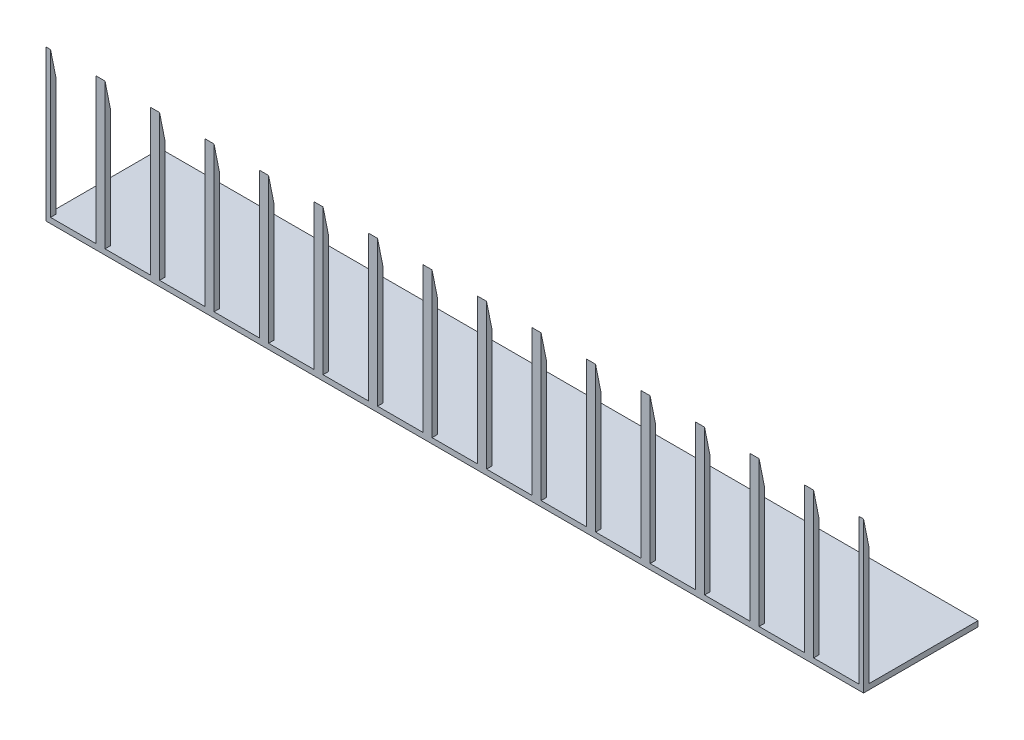
from build123d import *

# Parameters (mm, degrees)
SKETCH_1_W          = 450
SKETCH_1_H          = 60
EXTRUDE_1_DEPTH     = 3
EXTRUDE_2_DEPTH     = 3
CUT_EXTRUDE_1_DEPTH = 462.507313051


with BuildPart() as part:
    # 草图1 → 凸台-拉伸1 (new body)
    with BuildSketch(Plane(origin=(0, 0, 0), x_dir=(1, 0, 0), z_dir=(0, 1, 0))):
        with Locations((225, 30)):
            Rectangle(SKETCH_1_W, SKETCH_1_H)
    extrude(amount=EXTRUDE_1_DEPTH)

    # 草图3 → 凸台-拉伸2 (add)
    with BuildSketch(Plane.XY):
        Polygon((0, 0), (0, 83), (2.5, 83), (2.5, 3), (27.5, 3), (27.5, 83), (32.5, 83), (32.5, 3), (57.5, 3), (57.5, 83), (62.5, 83), (62.5, 3), (87.5, 3), (87.5, 83), (92.5, 83), (92.5, 3), (117.5, 3), (117.5, 83), (122.5, 83), (122.5, 3), (147.5, 3), (147.5, 83), (152.5, 83), (152.5, 3), (177.5, 3), (177.5, 83), (182.5, 83), (182.5, 3), (207.5, 3), (207.5, 83), (212.5, 83), (212.5, 3), (237.5, 3), (237.5, 83), (242.5, 83), (242.5, 3), (267.5, 3), (267.5, 83), (272.5, 83), (272.5, 3), (297.5, 3), (297.5, 83), (302.5, 83), (302.5, 3), (327.5, 3), (327.5, 83), (332.5, 83), (332.5, 3), (357.5, 3), (357.5, 83), (362.5, 83), (362.5, 3), (387.5, 3), (387.5, 83), (392.5, 83), (392.5, 3), (417.5, 3), (417.5, 83), (422.5, 83), (422.5, 3), (447.5, 3), (447.5, 83), (450, 83), (450, 3), (450, 0), align=None)
    extrude(amount=EXTRUDE_2_DEPTH)

    # 草图4 → 切除-拉伸1 (cut, through all)
    with BuildSketch(Plane.ZY):
        Polygon((3, 83), (0, 68), (0, 83), align=None)
    extrude(amount=-CUT_EXTRUDE_1_DEPTH, mode=Mode.SUBTRACT)


solid = part.part
